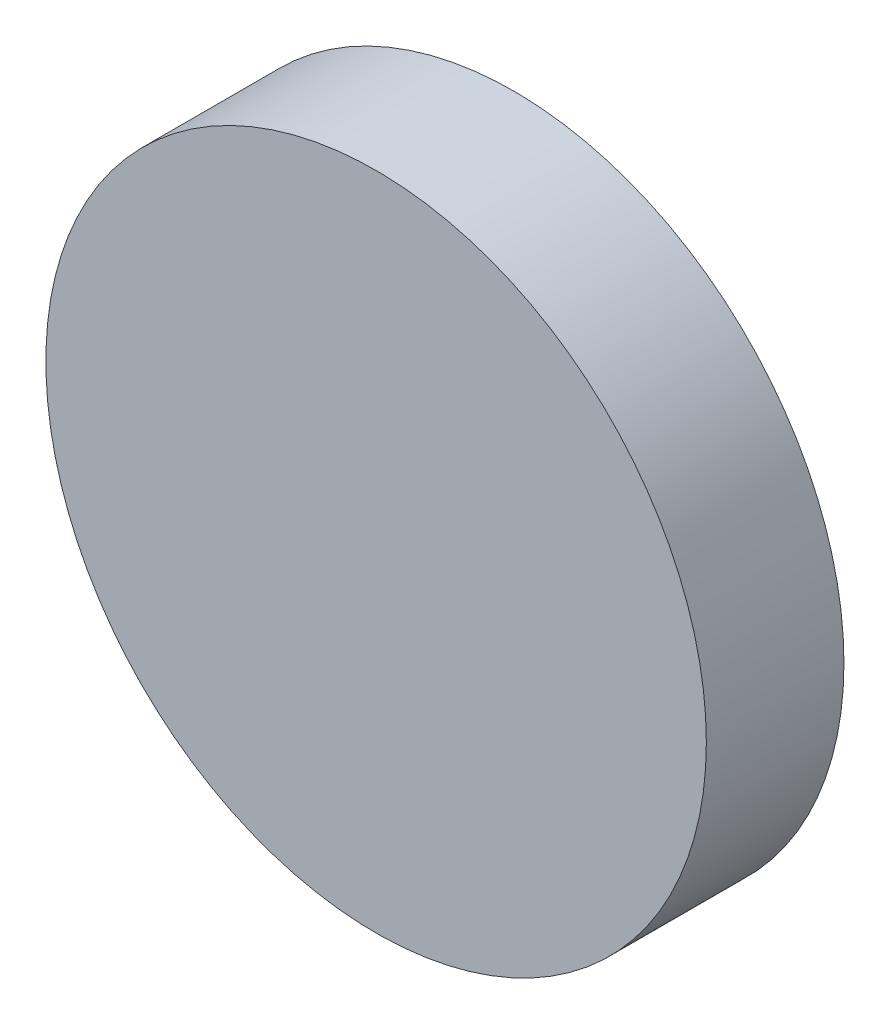
from build123d import *

# Parameters (mm, degrees)
SKETCH1_R           = 24
BOSS_EXTRUDE1_DEPTH = 10
CIRPATTERN1_COUNT   = 11


with BuildPart() as part:
    # Sketch1 → Boss-Extrude1 (new body)
    with BuildSketch(Plane.XY):
        Circle(SKETCH1_R)
    extrude(amount=BOSS_EXTRUDE1_DEPTH)

    # Sketch3 → Revolve1 (revolve)
    with BuildSketch(Plane(origin=(0, 0, 0), x_dir=(1, 0, 0), z_dir=(0, 1, 0))):
        with BuildLine():
            Line((18.8, 2), (18.8, -2))
            ThreePointArc((18.8, -2), (20.8, 0), (18.8, 2))
        make_face()
    revolve1 = revolve(axis=Axis((18.8, 0, -2), (0, 0, 1)))

    # CirPattern1: Revolve1 ×11 about axis
    cirpattern1_axis = Axis((0, 0, 0), (0, 0, 1))
    for i in range(1, CIRPATTERN1_COUNT):
        add(revolve1.rotate(cirpattern1_axis, i * 360 / CIRPATTERN1_COUNT))


solid = part.part
